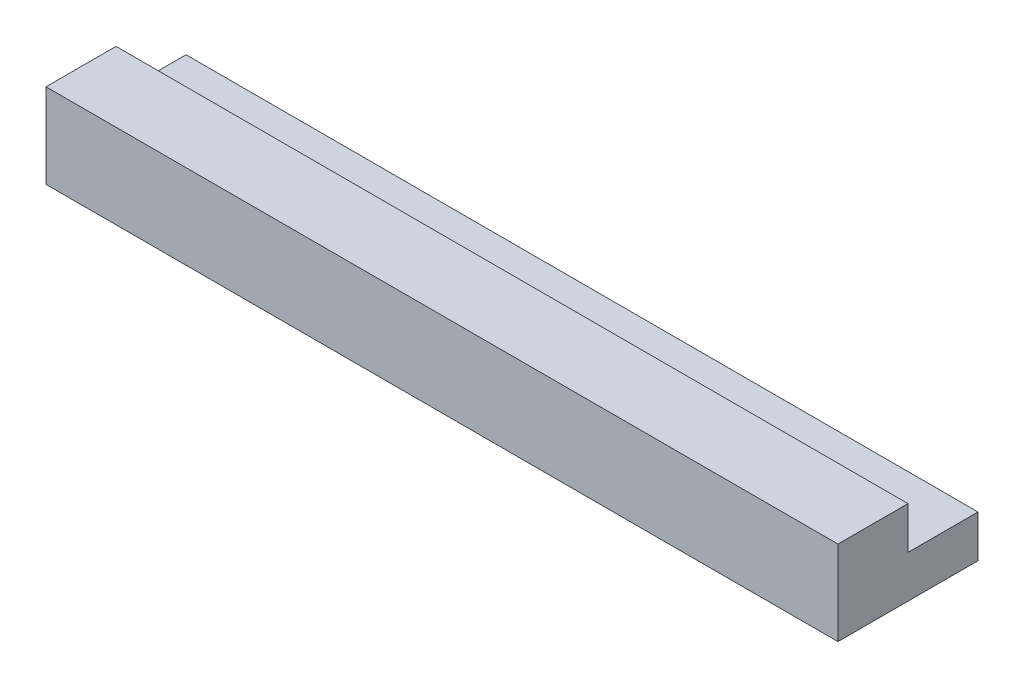
from build123d import *

# Parameters (mm, degrees)
SKETCH_1_W      = 32.8
SKETCH_1_H      = 5.8
EXTRUDE_1_DEPTH = 1.75
SKETCH_2_W      = 32.8
SKETCH_2_H      = 2.9
EXTRUDE_2_DEPTH = 1.75


with BuildPart() as part:
    # 草图1 → 凸台-拉伸1 (new body)
    with BuildSketch(Plane(origin=(0, 0, 0), x_dir=(1, 0, 0), z_dir=(0, 1, 0))):
        Rectangle(SKETCH_1_W, SKETCH_1_H)
    extrude(amount=EXTRUDE_1_DEPTH)

    # 草图2 → 凸台-拉伸2 (add)
    with BuildSketch(Plane(origin=(0, 1.75, 0), x_dir=(1, 0, 0), z_dir=(0, 1, 0))):
        with Locations((0, -1.45)):
            Rectangle(SKETCH_2_W, SKETCH_2_H)
    extrude(amount=EXTRUDE_2_DEPTH)


solid = part.part
